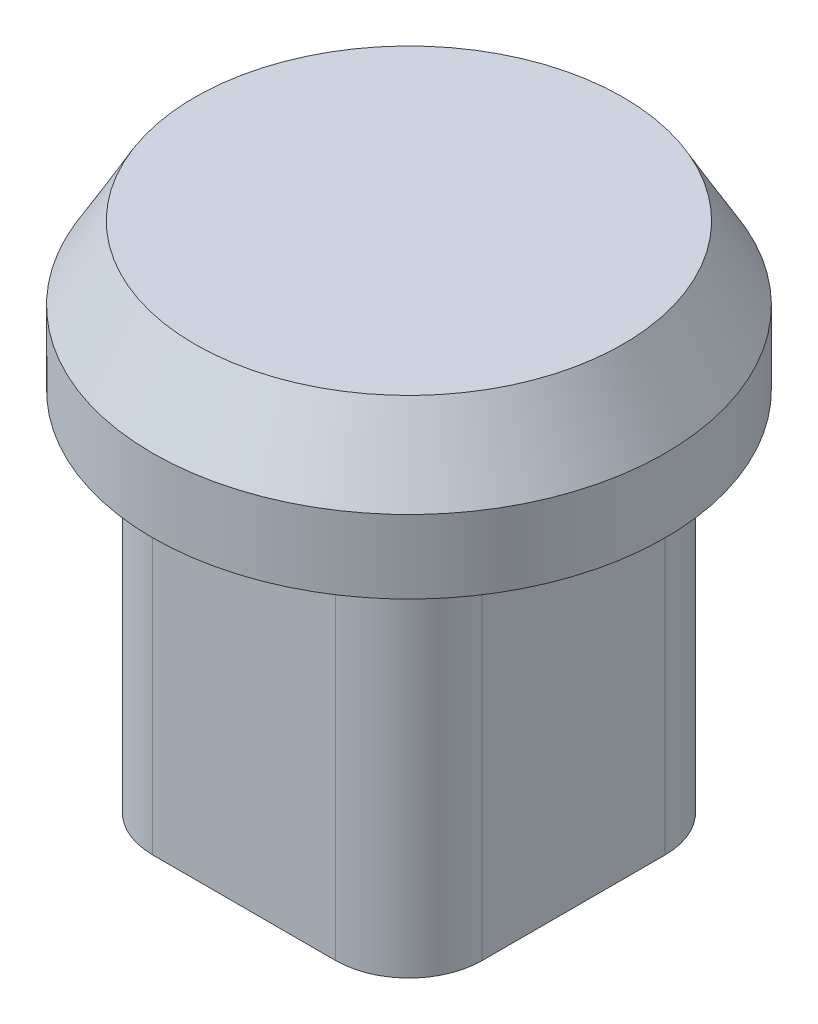
from build123d import *

# Parameters (mm, degrees)
SKETCH_2_W      = 4.5
SKETCH_2_H      = 4.5
EXTRUDE_1_DEPTH = 5
SKETCH_3_R      = 3.5
EXTRUDE_2_DEPTH = 2
CHAMFER_1_SIZE  = 1
CHAMFER_1_SIZE2 = 0.577350269
FILLET_1_R      = 1


with BuildPart() as part:
    # Эскиз2 → Бобышка-Вытянуть1 (new body)
    with BuildSketch(Plane(origin=(0, 0, 0), x_dir=(1, 0, 0), z_dir=(0, 1, 0))):
        Rectangle(SKETCH_2_W, SKETCH_2_H)
    extrude(amount=EXTRUDE_1_DEPTH)

    # Эскиз3 → Бобышка-Вытянуть2 (add)
    with BuildSketch(Plane(origin=(0, 5, 0), x_dir=(1, 0, 0), z_dir=(0, 1, 0))):
        with Locations(Location((0, 0, 0), (0, 0, 270))):
            Circle(SKETCH_3_R)
    extrude(amount=EXTRUDE_2_DEPTH)

    # Фаска1
    chamfer_1_edges = [part.edges().sort_by_distance(p)[0] for p in [
        (0, 7, -3.5),
    ]]
    chamfer_1_side = [part.faces().sort_by_distance(p)[0] for p in [
        (0, 6, -3.5),
    ]]
    chamfer(chamfer_1_edges, length=CHAMFER_1_SIZE, length2=CHAMFER_1_SIZE2, reference=chamfer_1_side[0])

    # Скругление1
    fillet_1_edges = [part.edges().sort_by_distance(p)[0] for p in [
        (2.25, 2.5, 2.25),
        (-2.25, 2.5, 2.25),
        (-2.25, 2.5, -2.25),
        (2.25, 2.5, -2.25),
    ]]
    fillet(fillet_1_edges, radius=FILLET_1_R)


solid = part.part
